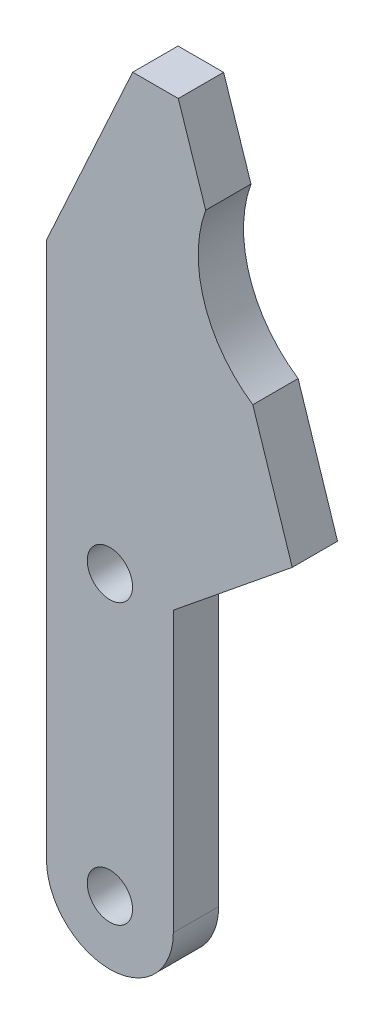
from build123d import *

# Parameters (mm, degrees)
SKETCH1_R           = 0.635
BOSS_EXTRUDE1_DEPTH = 1.27


with BuildPart() as part:
    # Sketch1 → Boss-Extrude1 (new body)
    with BuildSketch(Plane.XY):
        with BuildLine():
            Line((0, -11.938), (0, -4.107900924))
            Line((0, -4.107900924), (3.332623342, -1.403875353))
            Line((3.332623342, -1.403875353), (2.227712005, 1.993118473))
            ThreePointArc((2.227712005, 1.993118473), (0.867392125, 3.796133525), (0.906732127, 6.054404062))
            Line((0.906732127, 6.054404062), (0.139174217, 8.382))
            Line((0.139174217, 8.382), (-1.138657386, 8.382))
            Line((-1.138657386, 8.382), (-3.556, 3.099290623))
            Line((-3.556, 3.099290623), (-3.556, -11.938))
            ThreePointArc((-3.556, -11.938), (-1.778, -13.716), (0, -11.938))
        make_face()
        with Locations((-1.778, -11.938)):
            Circle(SKETCH1_R, mode=Mode.SUBTRACT)
        with Locations((-1.778, -4.107900924)):
            Circle(SKETCH1_R, mode=Mode.SUBTRACT)
    extrude(amount=BOSS_EXTRUDE1_DEPTH)


solid = part.part
